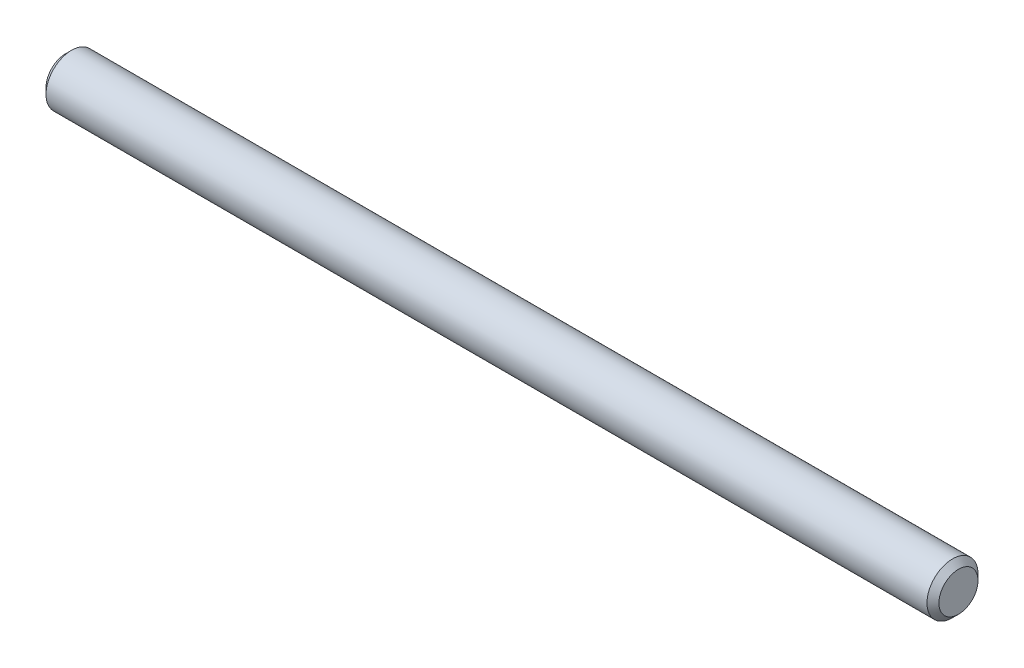
from build123d import *

# Parameters (mm, degrees)
BOSS_EXTRUDE1_DEPTH      = 70
BOSS_EXTRUDE1_DEPTH_BACK = 70
SKETCH2_R                = 4
CHAMFER1_SIZE            = 0.9375


with BuildPart() as part:
    # Sketch2 → Boss-Extrude1 (new, two sides: drawn at the far end of the back side and taken through both)
    with BuildSketch(Plane(origin=(0, 0, 0), x_dir=(0, 0, -1), z_dir=(1, 0, 0)).offset(-BOSS_EXTRUDE1_DEPTH_BACK)):
        Circle(SKETCH2_R)
    extrude(amount=BOSS_EXTRUDE1_DEPTH + BOSS_EXTRUDE1_DEPTH_BACK)

    # Chamfer1
    chamfer1_edges = [part.edges().sort_by_distance(p)[0] for p in [
        (-70, 0, 4),
        (70, 0, 4),
    ]]
    chamfer(chamfer1_edges, length=CHAMFER1_SIZE)


solid = part.part
